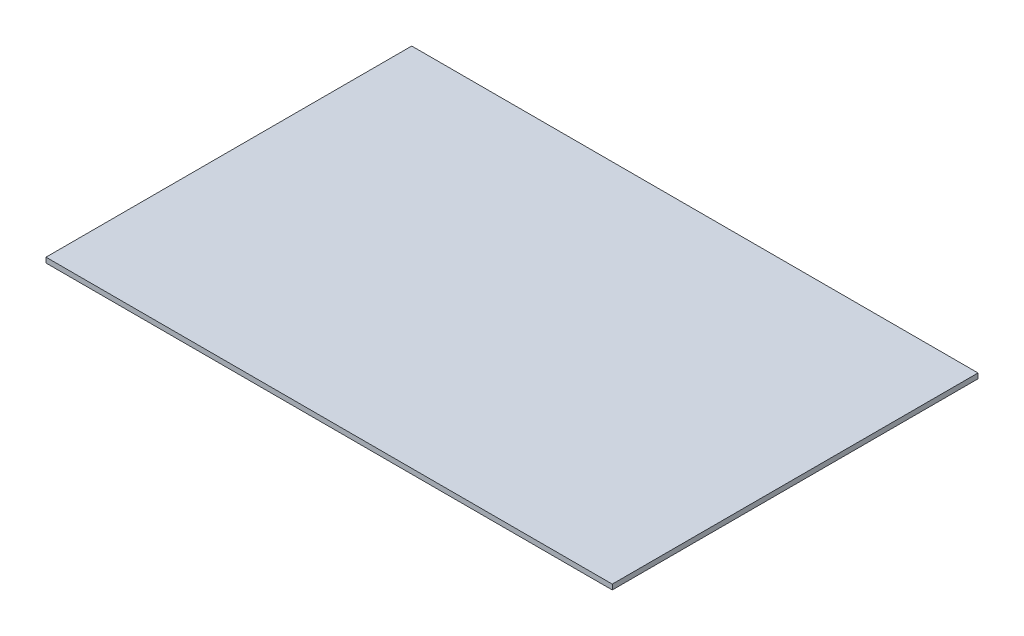
from build123d import *

# Parameters (mm, degrees)
SKETCH1_W           = 609.6
SKETCH1_H           = 393.7
BOSS_EXTRUDE1_DEPTH = 5.5


with BuildPart() as part:
    # Sketch1 → Boss-Extrude1 (new body)
    with BuildSketch(Plane(origin=(0, 0, 0), x_dir=(1, 0, 0), z_dir=(0, 1, 0))):
        with Locations((304.8, 196.85)):
            Rectangle(SKETCH1_W, SKETCH1_H)
    extrude(amount=BOSS_EXTRUDE1_DEPTH)


solid = part.part
